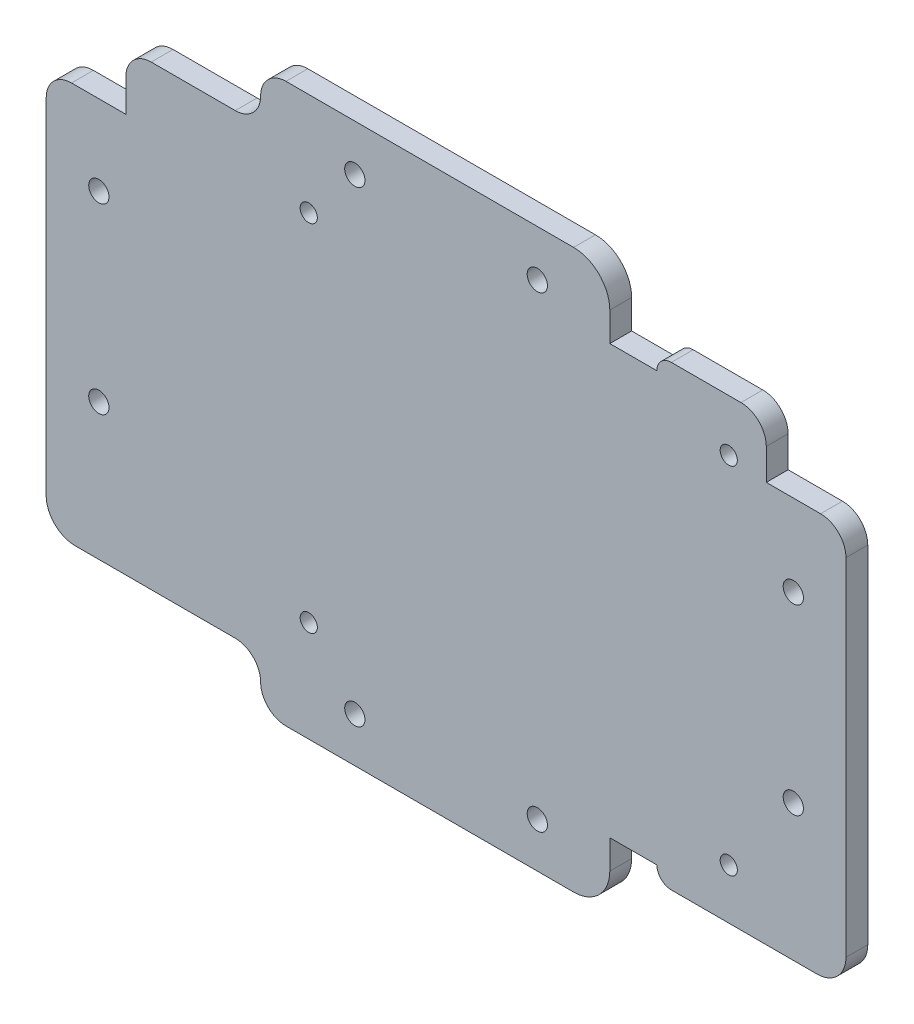
from build123d import *

# Parameters (mm, degrees)
CROQUIS1_R              = 1.392405063
CROQUIS1_R_2            = 1.113924051
SALIENTE_EXTRUIR1_DEPTH = 3
CROQUIS8_R              = 1.18
CORTAR_EXTRUIR1_DEPTH   = 10


with BuildPart() as part:
    # Croquis1 → Saliente-Extruir1 (new body)
    with BuildSketch(Plane.XY):
        with BuildLine():
            Line((73.906046363, 79.342028473), (73.906046363, 31.801341312))
            ThreePointArc((73.906046363, 31.801341312), (72.740829217, 28.988258277), (69.927746182, 27.823041131))
            Line((69.927746182, 27.823041131), (49.927651758, 27.823041131))
            ThreePointArc((49.927651758, 27.823041131), (48.521110241, 28.405649704), (47.938501668, 29.812191222))
            Line((47.938501668, 29.812191222), (41.473763874, 29.812191222))
            Line((41.473763874, 29.812191222), (41.473763874, 25.833891041))
            ThreePointArc((41.473763874, 25.833891041), (40.017242442, 22.317537246), (36.500888648, 20.861015815))
            Line((36.500888648, 20.861015815), (-3.002012677, 20.861015815))
            ThreePointArc((-3.002012677, 20.861015815), (-5.463460333, 21.880580817), (-6.483025335, 24.342028473))
            ThreePointArc((-6.483025335, 24.342028473), (-7.502590337, 26.803476129), (-9.964037993, 27.823041131))
            Line((-9.964037993, 27.823041131), (-31.953282507, 27.823041131))
            ThreePointArc((-31.953282507, 27.823041131), (-34.697951359, 28.916679938), (-35.931582688, 31.601341312))
            Line((-35.931582688, 31.601341312), (-35.931582688, 79.142028473))
            ThreePointArc((-35.931582688, 79.142028473), (-34.912017686, 81.603476129), (-32.45057003, 82.623041131))
            Line((-32.45057003, 82.623041131), (-24.991257191, 82.623041131))
            Line((-24.991257191, 82.623041131), (-24.991257191, 87.098628835))
            ThreePointArc((-24.991257191, 87.098628835), (-23.971692189, 89.560076491), (-21.510244533, 90.579641493))
            Line((-21.510244533, 90.579641493), (-9.964037993, 90.579641493))
            ThreePointArc((-9.964037993, 90.579641493), (-7.502590337, 91.599206495), (-6.483025335, 94.060654151))
            ThreePointArc((-6.483025335, 94.060654151), (-5.463460333, 96.522101807), (-3.002012677, 97.541666809))
            Line((-3.002012677, 97.541666809), (36.500888648, 97.541666809))
            ThreePointArc((36.500888648, 97.541666809), (40.017242442, 96.085145378), (41.473763874, 92.568791583))
            Line((41.473763874, 92.568791583), (41.473763874, 88.590491402))
            Line((41.473763874, 88.590491402), (47.938501668, 88.590491402))
            ThreePointArc((47.938501668, 88.590491402), (48.521110241, 89.99703292), (49.927651758, 90.579641493))
            Line((49.927651758, 90.579641493), (59.484708207, 90.579641493))
            ThreePointArc((59.484708207, 90.579641493), (61.946155863, 89.560076491), (62.965720865, 87.098628835))
            Line((62.965720865, 87.098628835), (62.965720865, 82.823041131))
            Line((62.965720865, 82.823041131), (70.425033704, 82.823041131))
            ThreePointArc((70.425033704, 82.823041131), (72.886481361, 81.803476129), (73.906046363, 79.342028473))
        make_face()
        with Locations((-28.70264158, 46.569695742)):
            Circle(CROQUIS1_R, mode=Mode.SUBTRACT)
        with Locations((-28.70264158, 71.632986882)):
            Circle(CROQUIS1_R, mode=Mode.SUBTRACT)
        with Locations((66.677105255, 46.569695742)):
            Circle(CROQUIS1_R, mode=Mode.SUBTRACT)
        with Locations((66.677105255, 71.632986882)):
            Circle(CROQUIS1_R, mode=Mode.SUBTRACT)
        with Locations((6.455586268, 91.17638652)):
            Circle(CROQUIS1_R, mode=Mode.SUBTRACT)
        with Locations((31.518877407, 91.17638652)):
            Circle(CROQUIS1_R, mode=Mode.SUBTRACT)
        with Locations((6.455586268, 27.026296104)):
            Circle(CROQUIS1_R, mode=Mode.SUBTRACT)
        with Locations((31.518877407, 27.026296104)):
            Circle(CROQUIS1_R, mode=Mode.SUBTRACT)
        with Locations((0.125454864, 83.46842992)):
            Circle(CROQUIS1_R_2, mode=Mode.SUBTRACT)
        with Locations((0.125454864, 34.734252705)):
            Circle(CROQUIS1_R_2, mode=Mode.SUBTRACT)
        with Locations((57.810807486, 34.734252705)):
            Circle(CROQUIS1_R_2, mode=Mode.SUBTRACT)
        with Locations((57.810807486, 83.46842992)):
            Circle(CROQUIS1_R_2, mode=Mode.SUBTRACT)
    extrude(amount=SALIENTE_EXTRUIR1_DEPTH)

    # Croquis8 → Cortar-Extruir1 (cut)
    with BuildSketch(Plane.XY.offset(3)):
        with Locations((0.125454864, 34.734252705)):
            Circle(CROQUIS8_R)
        with Locations((57.810807486, 34.734252705)):
            Circle(CROQUIS8_R)
        with Locations((0.125454864, 83.46842992)):
            Circle(CROQUIS8_R)
        with Locations((57.810807486, 83.46842992)):
            Circle(CROQUIS8_R)
    extrude(amount=-CORTAR_EXTRUIR1_DEPTH, mode=Mode.SUBTRACT)


solid = part.part
